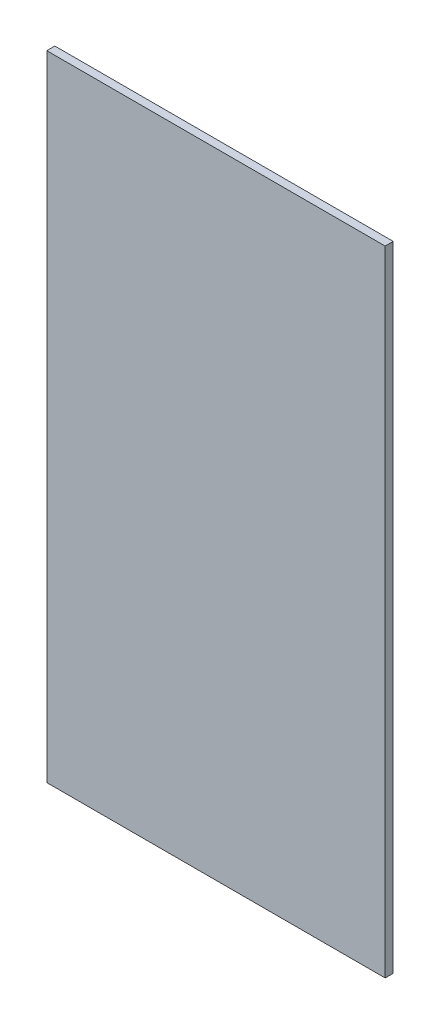
from build123d import *

# Parameters (mm, degrees)
SKETCH1_W           = 63
SKETCH1_H           = 118
BOSS_EXTRUDE1_DEPTH = 1.5


with BuildPart() as part:
    # Sketch1 → Boss-Extrude1 (new body)
    with BuildSketch(Plane.XY):
        with Locations((30, 57.5)):
            Rectangle(SKETCH1_W, SKETCH1_H)
    extrude(amount=BOSS_EXTRUDE1_DEPTH)


solid = part.part
